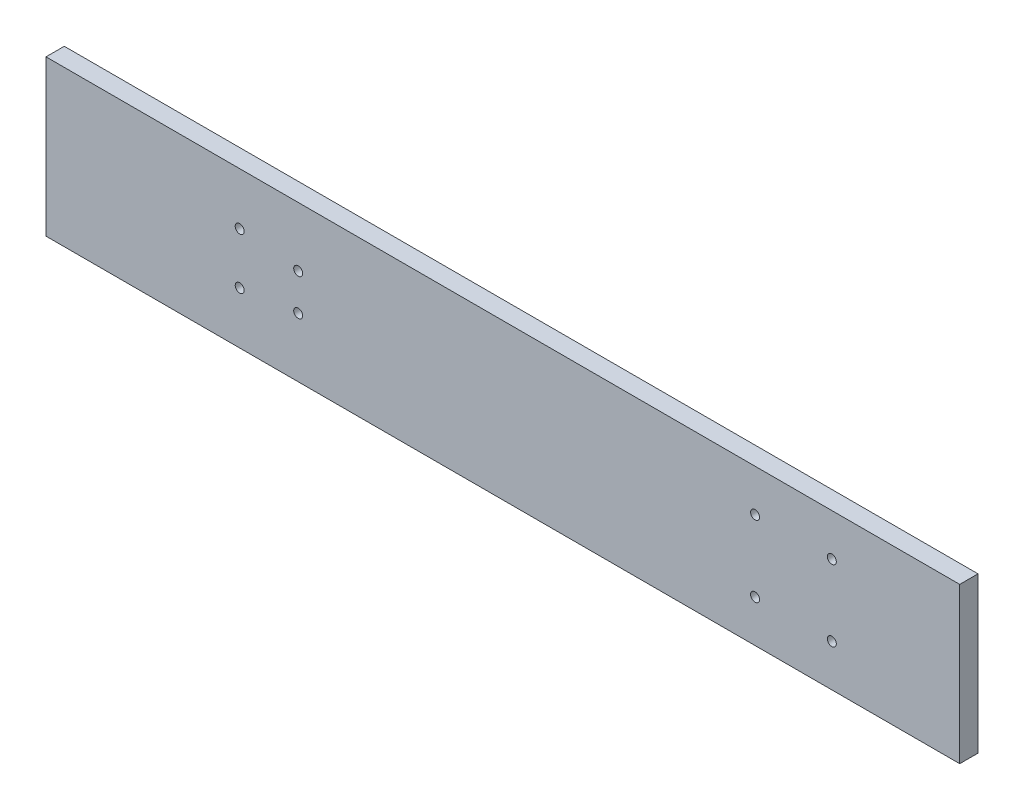
from build123d import *

# Parameters (mm, degrees)
SKETCH1_W                        = 500
SKETCH1_H                        = 85
BOSS_EXTRUDE1_DEPTH              = 10
F_10_0_1935_DIAMETER_HOLE1_D     = 4.9149
F_10_0_1935_DIAMETER_HOLE1_DEPTH = 5
F_10_0_1935_DIAMETER_HOLE1_TIP   = 1.476584928
F_10_0_1935_DIAMETER_HOLE2_D     = 4.9149
F_10_0_1935_DIAMETER_HOLE2_DEPTH = 5
F_10_0_1935_DIAMETER_HOLE2_TIP   = 1.476584928


with BuildPart() as part:
    # Sketch1 → Boss-Extrude1 (new body)
    with BuildSketch(Plane.XY):
        Rectangle(SKETCH1_W, SKETCH1_H)
    extrude(amount=BOSS_EXTRUDE1_DEPTH)

    # #10 (0.1935) Diameter Hole1
    with Locations(Plane.XY.offset(10)):
        with Locations((180, 19.5), (180, -19.5), (138, -19.5), (138, 19.5)):
            Hole(F_10_0_1935_DIAMETER_HOLE1_D / 2, depth=F_10_0_1935_DIAMETER_HOLE1_DEPTH)
            with Locations((0, 0, -(F_10_0_1935_DIAMETER_HOLE1_DEPTH + F_10_0_1935_DIAMETER_HOLE1_TIP / 2))):  # 118° drill point
                Cone(0, F_10_0_1935_DIAMETER_HOLE1_D / 2, F_10_0_1935_DIAMETER_HOLE1_TIP, mode=Mode.SUBTRACT)

    # #10 (0.1935) Diameter Hole2
    with Locations(Plane.XY.offset(10)):
        with Locations((-144, 14), (-112, 10), (-112, -10), (-144, -14)):
            Hole(F_10_0_1935_DIAMETER_HOLE2_D / 2, depth=F_10_0_1935_DIAMETER_HOLE2_DEPTH)
            with Locations((0, 0, -(F_10_0_1935_DIAMETER_HOLE2_DEPTH + F_10_0_1935_DIAMETER_HOLE2_TIP / 2))):  # 118° drill point
                Cone(0, F_10_0_1935_DIAMETER_HOLE2_D / 2, F_10_0_1935_DIAMETER_HOLE2_TIP, mode=Mode.SUBTRACT)


solid = part.part
